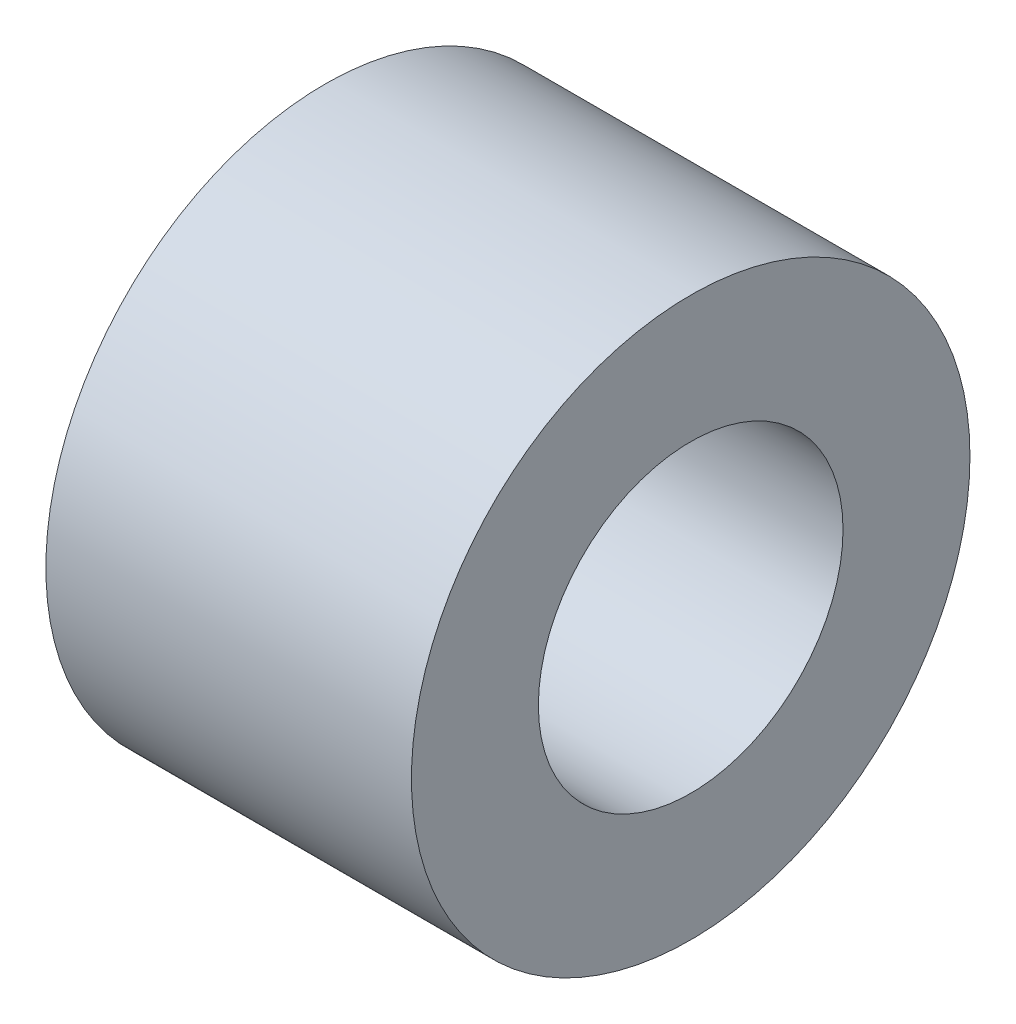
from build123d import *

# Parameters (mm, degrees)
SKETCH1_R           = 2.75
SKETCH1_R_2         = 1.5
BOSS_EXTRUDE1_DEPTH = 3.6


with BuildPart() as part:
    # Sketch1 → Boss-Extrude1 (new body)
    with BuildSketch(Plane(origin=(0, 0, 0), x_dir=(0, 0, -1), z_dir=(1, 0, 0))):
        Circle(SKETCH1_R)
        Circle(SKETCH1_R_2, mode=Mode.SUBTRACT)
    extrude(amount=BOSS_EXTRUDE1_DEPTH)


solid = part.part
